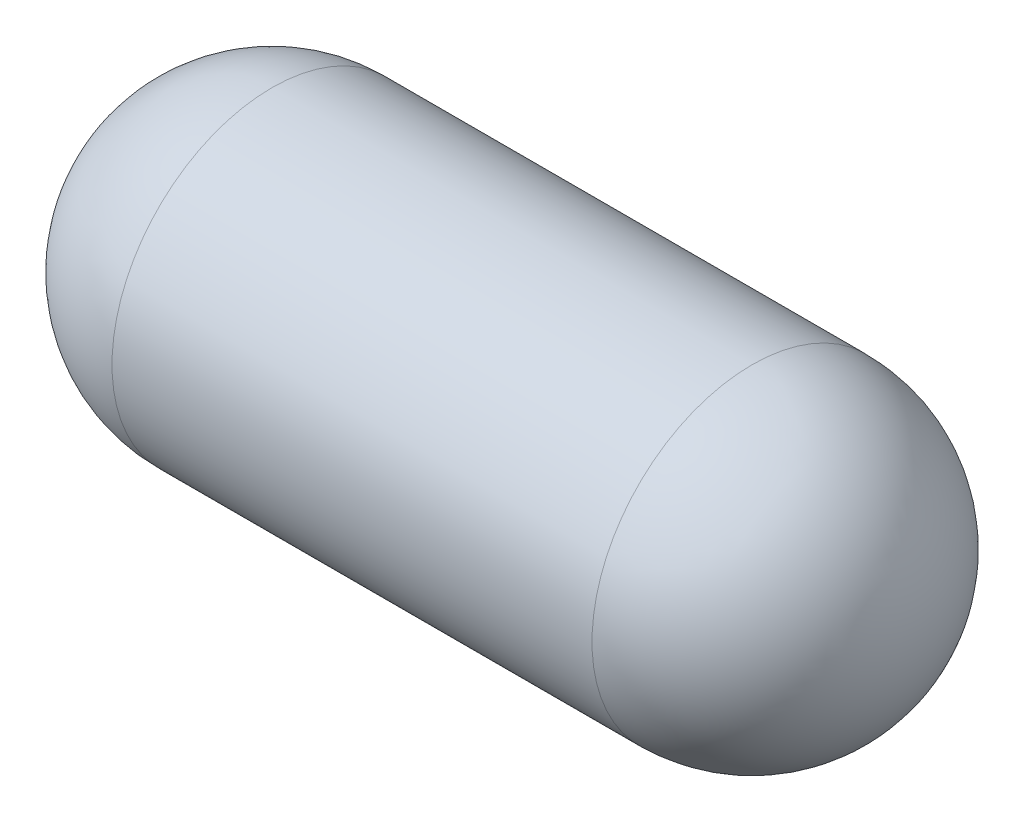
from build123d import *

# Parameters (mm, degrees)
SKETCH1_W           = 19.05
SKETCH1_H           = 6.35
BOSS_EXTRUDE1_DEPTH = 3.175


with BuildPart() as part:
    # Sketch1 → Boss-Extrude1 (new, symmetric)
    with BuildSketch(Plane.XY):
        Rectangle(SKETCH1_W, SKETCH1_H)
    extrude(amount=BOSS_EXTRUDE1_DEPTH, both=True)


with BuildPart() as body_2:
    # Sketch2 → Revolve2 (revolve)
    with BuildSketch(Plane.XY, mode=Mode.PRIVATE) as revolve2_sk:
        with BuildLine():
            Line((-12.5, 0), (12.5, 0))
            ThreePointArc((12.5, 0), (11.035533906, 3.535533906), (7.5, 5))
            Line((7.5, 5), (-7.5, 5))
            ThreePointArc((-7.5, 5), (-11.035533906, 3.535533906), (-12.5, 0))
        make_face()
    revolve(revolve2_sk.sketch.rotate(Axis((-12.5, 0, 0), (1, 0, 0)), 180), axis=Axis((-12.5, 0, 0), (1, 0, 0)))

    # Combine1: cut part
    add(part.part, mode=Mode.SUBTRACT)


solid = body_2.part
